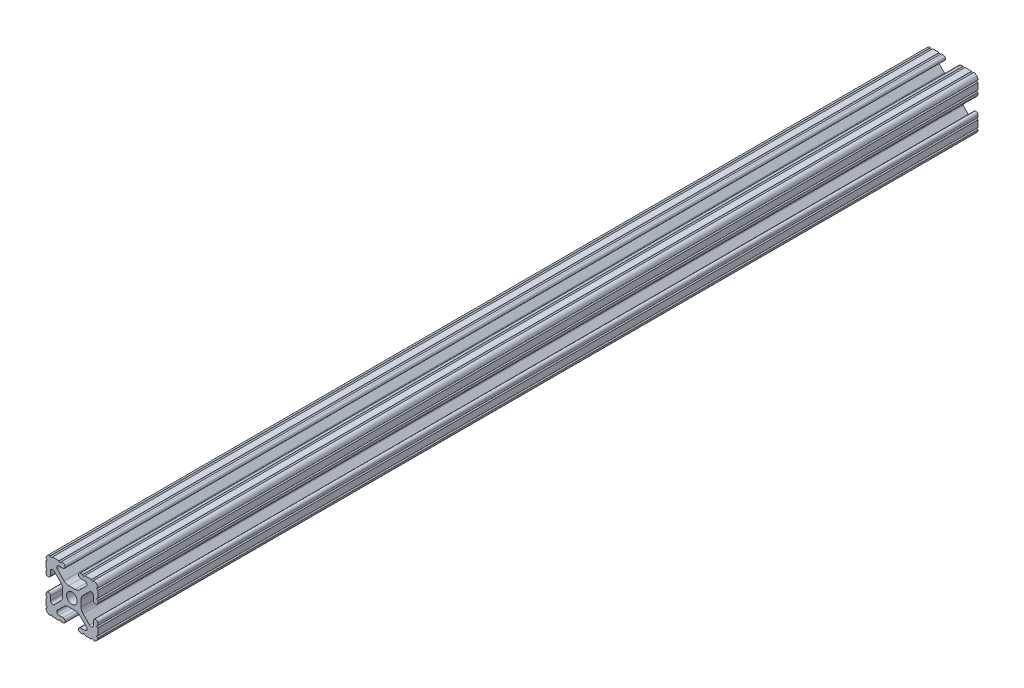
from build123d import *

# Parameters (mm, degrees)
SKETCH1_R      = 2.6035
EXTRUDE1_DEPTH = 431.8


with BuildPart() as part:
    # Sketch1 → Extrude1 (new body)
    with BuildSketch(Plane.XY):
        with BuildLine():
            Line((2.1336, -12.7), (2.1082, -12.7))
            ThreePointArc((2.1082, -12.7), (0.617477484, -12.082522516), (0, -10.5918))
            Line((0, -10.5918), (0, -10.5664))
            ThreePointArc((0, -10.5664), (0.508, -10.0584), (0, -9.5504))
            Line((0, -9.5504), (0, -6.3246))
            ThreePointArc((0, -6.3246), (0.508, -5.8166), (0, -5.3086))
            Line((0, -5.3086), (0, -4.3561))
            ThreePointArc((0, -4.3561), (1.1049, -3.2512), (2.2098, -4.3561))
            Line((2.2098, -4.3561), (2.2098, -6.370083786))
            ThreePointArc((2.2098, -6.370083786), (2.863795181, -7.348856743), (4.018336603, -7.119204175))
            Line((4.018336603, -7.119204175), (7.252896887, -3.88464389))
            ThreePointArc((7.252896887, -3.88464389), (7.941150373, -2.854599758), (8.182832857, -1.63957986))
            Line((8.182832857, -1.63957986), (8.182832857, 1.63957986))
            ThreePointArc((8.182832857, 1.63957986), (7.941150373, 2.854599758), (7.252896887, 3.88464389))
            Line((7.252896887, 3.88464389), (4.018336603, 7.119204175))
            ThreePointArc((4.018336603, 7.119204175), (2.863795181, 7.348856743), (2.2098, 6.370083786))
            Line((2.2098, 6.370083786), (2.2098, 4.3561))
            ThreePointArc((2.2098, 4.3561), (1.1049, 3.2512), (0, 4.3561))
            Line((0, 4.3561), (0, 5.3086))
            ThreePointArc((0, 5.3086), (0.508, 5.8166), (0, 6.3246))
            Line((0, 6.3246), (0, 9.5504))
            ThreePointArc((0, 9.5504), (0.508, 10.0584), (0, 10.5664))
            Line((0, 10.5664), (0, 10.5918))
            ThreePointArc((0, 10.5918), (0.617477484, 12.082522516), (2.1082, 12.7))
            Line((2.1082, 12.7), (2.1336, 12.7))
            ThreePointArc((2.1336, 12.7), (2.6416, 12.192), (3.1496, 12.7))
            Line((3.1496, 12.7), (6.3754, 12.7))
            ThreePointArc((6.3754, 12.7), (6.8834, 12.192), (7.3914, 12.7))
            Line((7.3914, 12.7), (8.3439, 12.7))
            ThreePointArc((8.3439, 12.7), (9.4488, 11.5951), (8.3439, 10.4902))
            Line((8.3439, 10.4902), (6.329916214, 10.4902))
            ThreePointArc((6.329916214, 10.4902), (5.351143257, 9.836204819), (5.580795825, 8.681663397))
            Line((5.580795825, 8.681663397), (8.81535611, 5.447103113))
            ThreePointArc((8.81535611, 5.447103113), (9.845400242, 4.758849627), (11.06042014, 4.517167143))
            Line((11.06042014, 4.517167143), (14.33957986, 4.517167143))
            ThreePointArc((14.33957986, 4.517167143), (15.554599758, 4.758849627), (16.58464389, 5.447103113))
            Line((16.58464389, 5.447103113), (19.819204175, 8.681663397))
            ThreePointArc((19.819204175, 8.681663397), (20.048856743, 9.836204819), (19.070083786, 10.4902))
            Line((19.070083786, 10.4902), (17.0561, 10.4902))
            ThreePointArc((17.0561, 10.4902), (15.9512, 11.5951), (17.0561, 12.7))
            Line((17.0561, 12.7), (18.0086, 12.7))
            ThreePointArc((18.0086, 12.7), (18.5166, 12.192), (19.0246, 12.7))
            Line((19.0246, 12.7), (22.2504, 12.7))
            ThreePointArc((22.2504, 12.7), (22.7584, 12.192), (23.2664, 12.7))
            Line((23.2664, 12.7), (23.2918, 12.7))
            ThreePointArc((23.2918, 12.7), (24.782522516, 12.082522516), (25.4, 10.5918))
            Line((25.4, 10.5918), (25.4, 10.5664))
            ThreePointArc((25.4, 10.5664), (24.892, 10.0584), (25.4, 9.5504))
            Line((25.4, 9.5504), (25.4, 6.3246))
            ThreePointArc((25.4, 6.3246), (24.892, 5.8166), (25.4, 5.3086))
            Line((25.4, 5.3086), (25.4, 4.3561))
            ThreePointArc((25.4, 4.3561), (24.2951, 3.2512), (23.1902, 4.3561))
            Line((23.1902, 4.3561), (23.1902, 6.370083786))
            ThreePointArc((23.1902, 6.370083786), (22.536204819, 7.348856743), (21.381663397, 7.119204175))
            Line((21.381663397, 7.119204175), (18.147103113, 3.88464389))
            ThreePointArc((18.147103113, 3.88464389), (17.458849627, 2.854599758), (17.217167143, 1.63957986))
            Line((17.217167143, 1.63957986), (17.217167143, -1.63957986))
            ThreePointArc((17.217167143, -1.63957986), (17.458849627, -2.854599758), (18.147103113, -3.88464389))
            Line((18.147103113, -3.88464389), (21.381663397, -7.119204175))
            ThreePointArc((21.381663397, -7.119204175), (22.536204819, -7.348856743), (23.1902, -6.370083786))
            Line((23.1902, -6.370083786), (23.1902, -4.3561))
            ThreePointArc((23.1902, -4.3561), (24.2951, -3.2512), (25.4, -4.3561))
            Line((25.4, -4.3561), (25.4, -5.3086))
            ThreePointArc((25.4, -5.3086), (24.892, -5.8166), (25.4, -6.3246))
            Line((25.4, -6.3246), (25.4, -9.5504))
            ThreePointArc((25.4, -9.5504), (24.892, -10.0584), (25.4, -10.5664))
            Line((25.4, -10.5664), (25.4, -10.5918))
            ThreePointArc((25.4, -10.5918), (24.782522516, -12.082522516), (23.2918, -12.7))
            Line((23.2918, -12.7), (23.2664, -12.7))
            ThreePointArc((23.2664, -12.7), (22.7584, -12.192), (22.2504, -12.7))
            Line((22.2504, -12.7), (19.0246, -12.7))
            ThreePointArc((19.0246, -12.7), (18.5166, -12.192), (18.0086, -12.7))
            Line((18.0086, -12.7), (17.0561, -12.7))
            ThreePointArc((17.0561, -12.7), (15.9512, -11.5951), (17.0561, -10.4902))
            Line((17.0561, -10.4902), (19.070083786, -10.4902))
            ThreePointArc((19.070083786, -10.4902), (20.048856743, -9.836204819), (19.819204175, -8.681663397))
            Line((19.819204175, -8.681663397), (16.58464389, -5.447103113))
            ThreePointArc((16.58464389, -5.447103113), (15.554599758, -4.758849627), (14.33957986, -4.517167143))
            Line((14.33957986, -4.517167143), (11.06042014, -4.517167143))
            ThreePointArc((11.06042014, -4.517167143), (9.845400242, -4.758849627), (8.81535611, -5.447103113))
            Line((8.81535611, -5.447103113), (5.580795825, -8.681663397))
            ThreePointArc((5.580795825, -8.681663397), (5.351143257, -9.836204819), (6.329916214, -10.4902))
            Line((6.329916214, -10.4902), (8.3439, -10.4902))
            ThreePointArc((8.3439, -10.4902), (9.4488, -11.5951), (8.3439, -12.7))
            Line((8.3439, -12.7), (7.3914, -12.7))
            ThreePointArc((7.3914, -12.7), (6.8834, -12.192), (6.3754, -12.7))
            Line((6.3754, -12.7), (3.1496, -12.7))
            ThreePointArc((3.1496, -12.7), (2.6416, -12.192), (2.1336, -12.7))
        make_face()
        with Locations((12.7, 0)):
            Circle(SKETCH1_R, mode=Mode.SUBTRACT)
    extrude(amount=-EXTRUDE1_DEPTH)


solid = part.part
